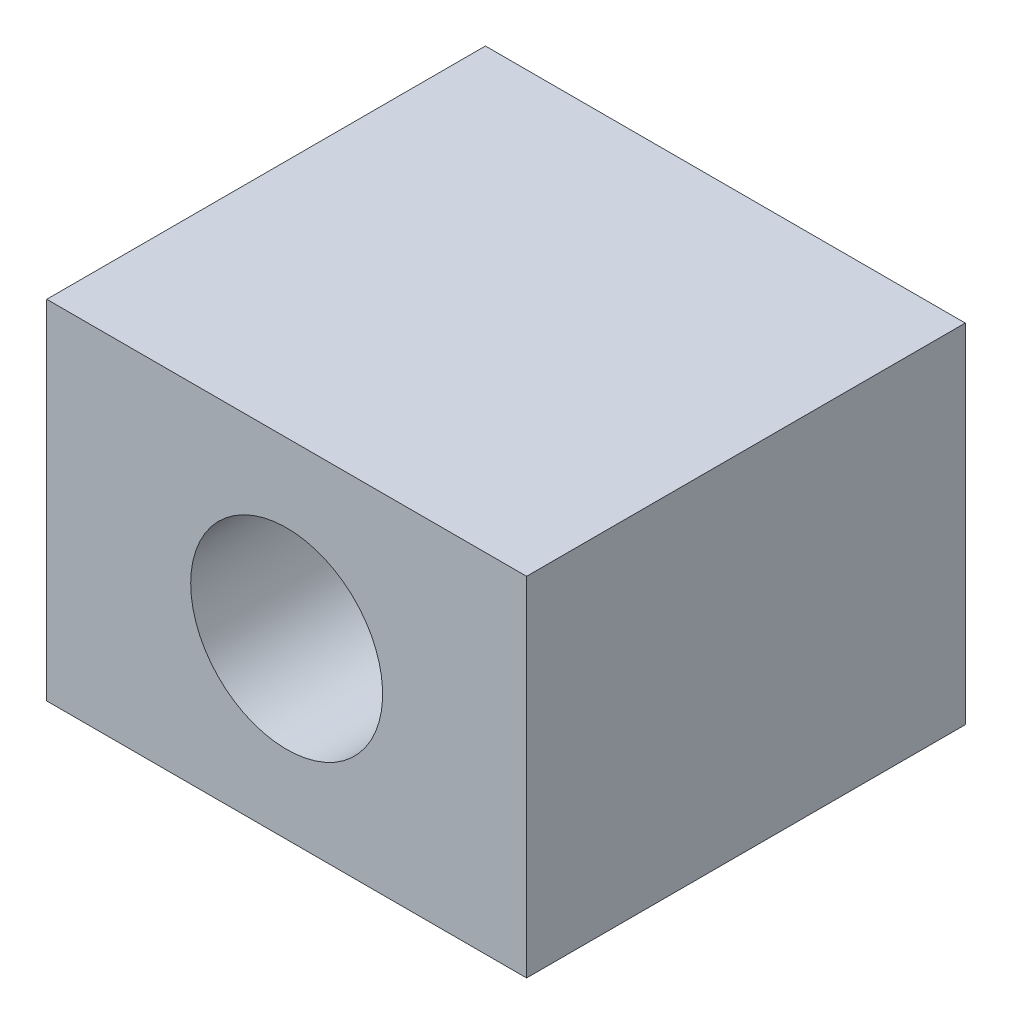
from build123d import *

# Parameters (mm, degrees)
SKETCH_1_R            = 15
EXTRUDE_1_DEPTH       = 5
HOLE_WIZARD_M3_1_D    = 2.5
SKETCH_4_R            = 6
EXTRUDE_2_DEPTH       = 10
SKETCH_5_R            = 2.5
CUT_EXTRUDE_1_DEPTH   = 26.980762114
FILLET_1_R            = 0.5
SKETCH_6_OUTSIDE_W    = 41
SKETCH_6_OUTSIDE_H    = 26
SKETCH_6_OUTSIDE_W_2  = 4
SKETCH_6_OUTSIDE_H_2  = 2.9
CUT_EXTRUDE_3_DEPTH   = 26.980762114
SKETCH_7_W            = 4
SKETCH_7_H            = 1.308251765
EXTRUDE_3_DEPTH       = 2.9
HOLE_WIZARD_M2_1_D    = 1.6
SKETCH_12_OUTSIDE_W   = 7.336
SKETCH_12_OUTSIDE_H   = 7.836
SKETCH_12_OUTSIDE_W_2 = 4
SKETCH_12_OUTSIDE_H_2 = 4.156854249
CUT_EXTRUDE_4_DEPTH   = 7.957729671
SKETCH_13_W           = 4
SKETCH_13_H           = 0.5
CUT_EXTRUDE_5_DEPTH   = 7.664082833


with BuildPart() as part:
    # 草图1 → 凸台-拉伸1 (new body)
    with BuildSketch(Plane(origin=(0, 0, 0), x_dir=(1, 0, 0), z_dir=(0, 1, 0))):
        with Locations(Location((0, 0, 0), (0, 0, 270))):
            Circle(SKETCH_1_R)
    extrude(amount=EXTRUDE_1_DEPTH)

    # M3 螺纹孔的螺纹孔钻头1 (through all)
    with Locations(Plane(origin=(0, 5, 0), x_dir=(1, 0, 0), z_dir=(0, 1, 0))):
        with Locations((12, 0), (0, 12), (0, -12), (-12, 0)):
            Hole(HOLE_WIZARD_M3_1_D / 2)

    # 草图4 → 凸台-拉伸2 (add)
    with BuildSketch(Plane(origin=(0, 5, 0), x_dir=(1, 0, 0), z_dir=(0, 1, 0))):
        with Locations(Location((0, 0, 0), (0, 0, 270))):
            Circle(SKETCH_4_R)
    extrude(amount=EXTRUDE_2_DEPTH)

    # 草图5 → 切除-拉伸1 (cut, through all)
    with BuildSketch(Plane(origin=(0, 15, 0), x_dir=(1, 0, 0), z_dir=(0, 1, 0))):
        with Locations(Location((0, 0, 0), (0, 0, 270))):
            Circle(SKETCH_5_R)
    extrude(amount=-CUT_EXTRUDE_1_DEPTH, mode=Mode.SUBTRACT)

    # 圆角1
    fillet_1_edges = [part.edges().sort_by_distance(p)[0] for p in [
        (0, 5, -6),
    ]]
    fillet(fillet_1_edges, radius=FILLET_1_R)

    # 草图6 outside → 切除-拉伸3 (cut, through all)
    with BuildSketch(Plane.XY):
        with Locations((0, 7.5)):
            Rectangle(SKETCH_6_OUTSIDE_W, SKETCH_6_OUTSIDE_H)
        with Locations((0, 9.55)):
            Rectangle(SKETCH_6_OUTSIDE_W_2, SKETCH_6_OUTSIDE_H_2, mode=Mode.SUBTRACT)
    extrude(amount=-CUT_EXTRUDE_3_DEPTH, mode=Mode.SUBTRACT)


with BuildPart() as body_2:
    # of the pieces the cut leaves, the one that is kept (cut_extrude_3_keep)
    add(part.part.solids().sort_by_distance((2, 8.1, -1.5))[0])

    # 草图7 → 凸台-拉伸3 (add, through all)
    with BuildSketch(Plane(origin=(0, 11, 0), x_dir=(1, 0, 0), z_dir=(0, 1, 0))):
        with Locations((0, 2.154125882)):
            Rectangle(SKETCH_7_W, SKETCH_7_H)
    extrude(amount=-EXTRUDE_3_DEPTH)

    # M2 螺纹孔的螺纹孔钻头1 (through all)
    with Locations(Plane.XY.offset(-1.5)):
        with Locations((0, 9.55)):
            Hole(HOLE_WIZARD_M2_1_D / 2)

    # 草图12 outside → 切除-拉伸4 (cut, through all)
    with BuildSketch(Plane.XZ.offset(-8.1)):
        with Locations((0, -3.75)):
            Rectangle(SKETCH_12_OUTSIDE_W, SKETCH_12_OUTSIDE_H)
        with Locations((0, -3.578427125)):
            Rectangle(SKETCH_12_OUTSIDE_W_2, SKETCH_12_OUTSIDE_H_2, mode=Mode.SUBTRACT)
    extrude(amount=-CUT_EXTRUDE_4_DEPTH, mode=Mode.SUBTRACT)

    # 草图13 → 切除-拉伸5 (cut, through all)
    with BuildSketch(Plane.XZ.offset(-8.1)):
        with Locations((0, -1.75)):
            Rectangle(SKETCH_13_W, SKETCH_13_H)
    extrude(amount=-CUT_EXTRUDE_5_DEPTH, mode=Mode.SUBTRACT)


solid = body_2.part
